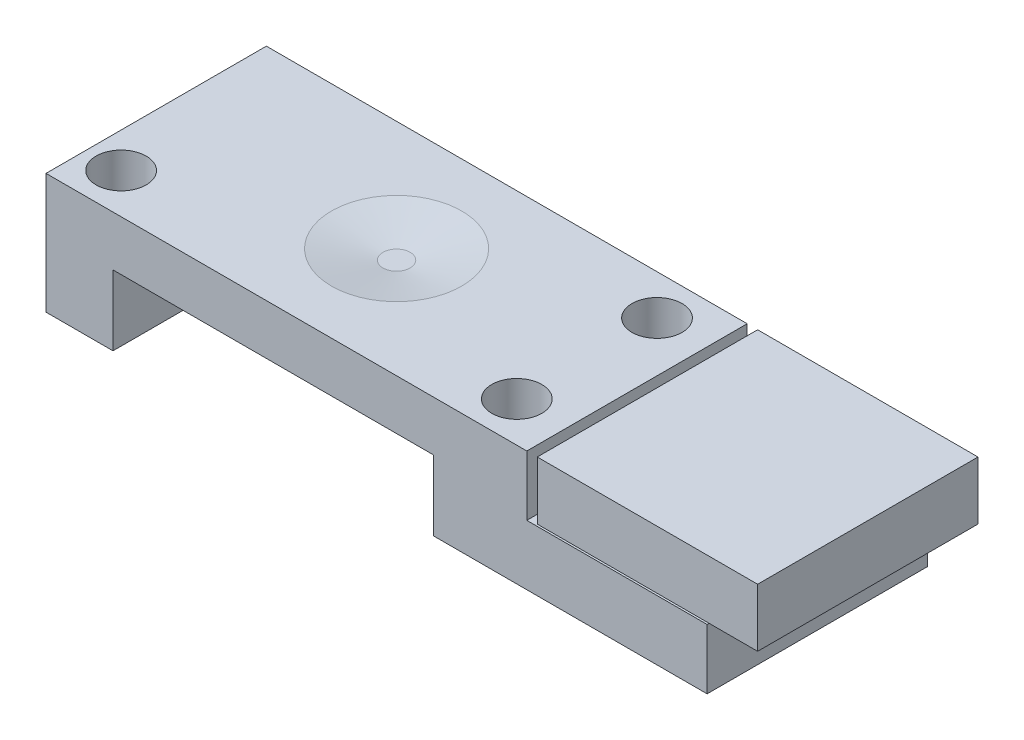
from build123d import *

# Parameters (mm, degrees)
BOSS_EXTRUDE1_DEPTH        = 11
F_2_5_2_5_DIAMETER_HOLE1_D = 2.5
SKETCH5_W                  = 11
SKETCH5_H                  = 2.9
BOSS_EXTRUDE2_DEPTH        = 11
SKETCH6_R                  = 3.25
CUT_EXTRUDE1_DEPTH         = 0.5
CUT_EXTRUDE1_DRAFT         = -79


with BuildPart() as part:
    # Sketch1 → Boss-Extrude1 (new body)
    with BuildSketch(Plane.XY):
        Polygon((19.343787585, 0), (24, 0), (33, 0), (33, 3), (24, 3), (24, 6), (0, 6), (0, 0), (3.343787585, 0), (3.343787585, 3.5), (19.343787585, 3.5), align=None)
    extrude(amount=BOSS_EXTRUDE1_DEPTH)

    # Ø2.5 (2.5) Diameter Hole1 (through all)
    with Locations(Plane(origin=(0, 6, 0), x_dir=(1, 0, 0), z_dir=(0, 1, 0))):
        with Locations((1.75, -9), (21.5, -2), (21.5, -9)):
            Hole(F_2_5_2_5_DIAMETER_HOLE1_D / 2)


with BuildPart() as body_2:
    # Sketch5 → Boss-Extrude2 (new body)
    with BuildSketch(Plane.XY.offset(11)):
        with Locations((30.021128577, 4.55)):
            Rectangle(SKETCH5_W, SKETCH5_H)
    extrude(amount=-BOSS_EXTRUDE2_DEPTH)


with BuildPart() as cut_extrude1_tool:
    # Sketch6 → Cut-Extrude1 (with draft: the straight prism first)
    with BuildSketch(Plane(origin=(0, 6, 0), x_dir=(1, 0, 0), z_dir=(0, 1, 0))):
        with Locations((12, -5.5)):
            Circle(SKETCH6_R)
    extrude(amount=-CUT_EXTRUDE1_DEPTH)
    # Cut-Extrude1: the draft: its side faces are tilted about the plane it starts from
    cut_extrude1_sides = [cut_extrude1_tool.faces().sort_by_distance(p)[0] for p in [
        (8.75, 5.75, 5.5),
    ]]
    draft(cut_extrude1_sides, Plane(origin=(0, 6, 0), x_dir=(1, 0, 0), z_dir=(0, 1, 0)), CUT_EXTRUDE1_DRAFT)


with BuildPart() as part_1:
    add(part.part)

    # Cut-Extrude1: cut by cut_extrude1_tool
    add(cut_extrude1_tool.part, mode=Mode.SUBTRACT)


solid = Compound([body_2.part, part_1.part])
